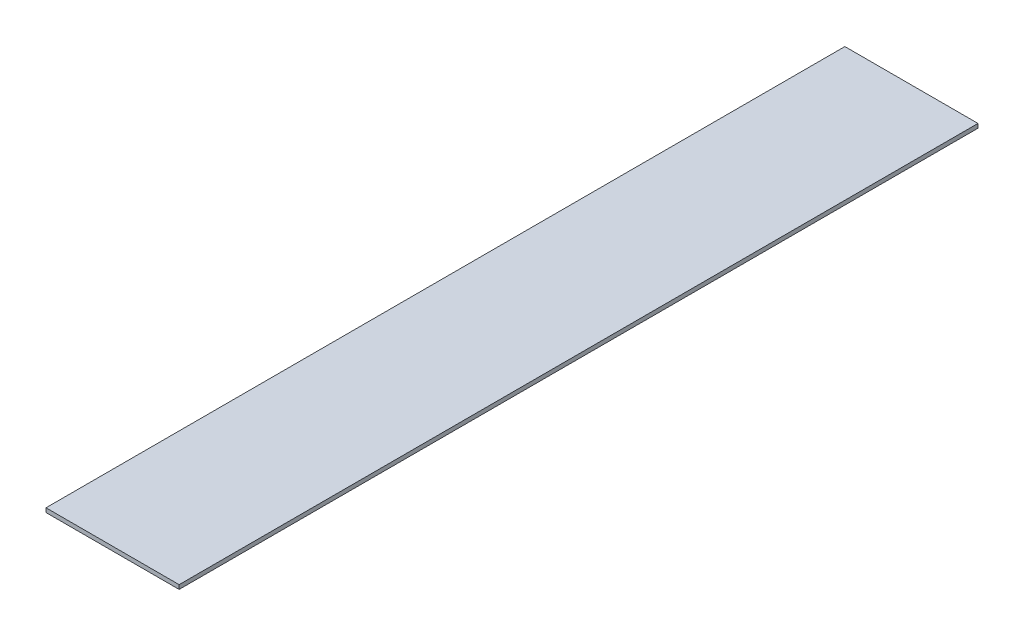
from build123d import *

# Parameters (mm, degrees)
BOSS_EXTRUDE1_DEPTH      = 76.2
BOSS_EXTRUDE1_DEPTH_BACK = 76.2
SKETCH3_W                = 25.4
SKETCH3_H                = 0.79375


with BuildPart() as part:
    # Sketch3 → Boss-Extrude1 (new, two sides: drawn at the far end of the back side and taken through both)
    with BuildSketch(Plane.XY.offset(-BOSS_EXTRUDE1_DEPTH_BACK)):
        Rectangle(SKETCH3_W, SKETCH3_H)
    extrude(amount=BOSS_EXTRUDE1_DEPTH + BOSS_EXTRUDE1_DEPTH_BACK)


solid = part.part
